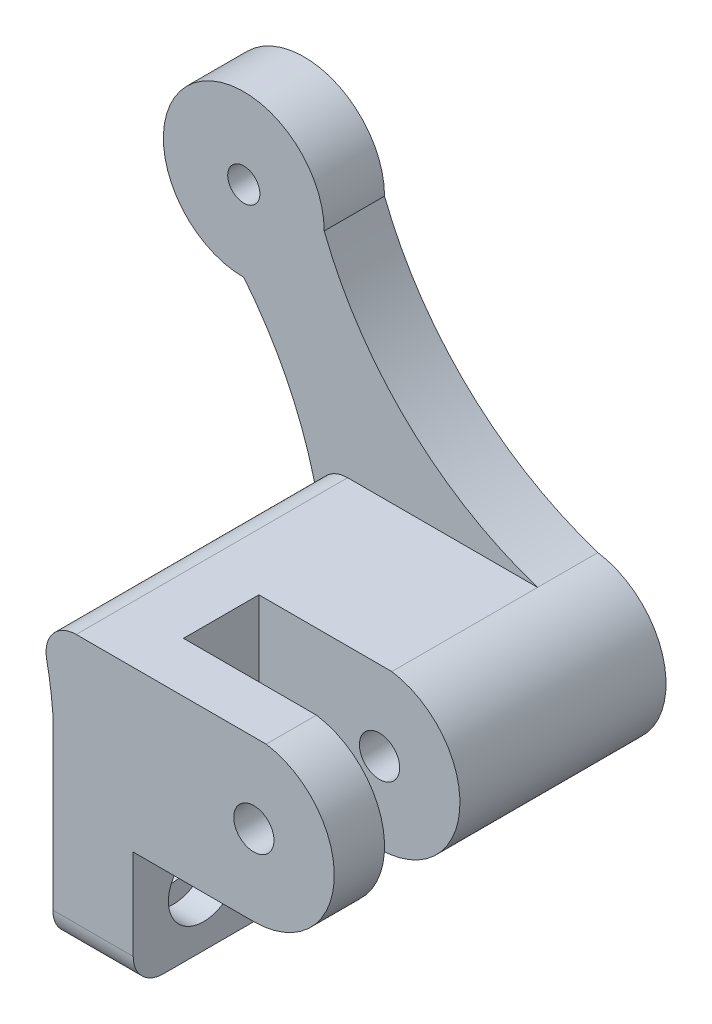
from build123d import *

# Parameters (mm, degrees)
SKETCH1_R           = 2
SKETCH1_R_2         = 1.6
BOSS_EXTRUDE6_DEPTH = 6
SKETCH1_6_R         = 2
BOSS_EXTRUDE7_DEPTH = 33
CUT_EXTRUDE1_START  = -12.5
CUT_EXTRUDE1_DEPTH  = 7.5
FILLET1_R           = 3
SKETCH3_R           = 1.6
CUT_EXTRUDE2_DEPTH  = 17.5
SKETCH4_R           = 3.5
SKETCH4_R_2         = 1.6
CUT_EXTRUDE3_DEPTH  = 3
FILLET2_R           = 3
SKETCH5_R           = 3.5
CUT_EXTRUDE6_DEPTH  = 4


with BuildPart() as part:
    # Sketch1 → Boss-Extrude6 (new body)
    with BuildSketch(Plane.XY):
        with BuildLine():
            Line((-12, -8), (0, -8))
            ThreePointArc((0, -8), (7.976389989, -0.614168335), (1.22471154, 7.905699314))
            ThreePointArc((1.22471154, 7.905699314), (-11.642163109, 15.571502149), (-20, 28))
            ThreePointArc((-20, 28), (-33.656854249, 33.656854249), (-28, 20))
            ThreePointArc((-28, 20), (-22.4925387, 10.60298452), (-20, 0))
            Line((-20, 0), (-20, -20))
            Line((-20, -20), (-12, -20))
            Line((-12, -20), (-12, -8))
        make_face()
        Circle(SKETCH1_R, mode=Mode.SUBTRACT)
        with Locations((-28, 28)):
            Circle(SKETCH1_R_2, mode=Mode.SUBTRACT)
    extrude(amount=BOSS_EXTRUDE6_DEPTH)

    # Sketch1<6> → Boss-Extrude7 (add)
    with BuildSketch(Plane.XY):
        with BuildLine():
            Line((-12, -8), (0, -8))
            ThreePointArc((0, -8), (7.976389989, -0.614168335), (1.22471154, 7.905699314))
            Line((1.22471154, 7.905699314), (-21.534392451, 7.905699314))
            ThreePointArc((-21.534392451, 7.905699314), (-20.548705212, 3.995255894), (-20, 0))
            Line((-20, 0), (-20, -20))
            Line((-20, -20), (-12, -20))
            Line((-12, -20), (-12, -8))
        make_face()
        Circle(SKETCH1_6_R, mode=Mode.SUBTRACT)
    extrude(amount=BOSS_EXTRUDE7_DEPTH)

    # Sketch2 → Cut-Extrude1 (cut)
    with BuildSketch(Plane.XY.offset(33).offset(CUT_EXTRUDE1_START)):
        with BuildLine():
            Line((-12, -8), (-12, 7.905699314))
            Line((-12, 7.905699314), (1.22471154, 7.905699314))
            ThreePointArc((1.22471154, 7.905699314), (7.976389989, -0.614168335), (0, -8))
            Line((0, -8), (-12, -8))
        make_face()
    extrude(amount=CUT_EXTRUDE1_DEPTH, mode=Mode.SUBTRACT)

    # Fillet1
    fillet1_edges = [part.edges().sort_by_distance(p)[0] for p in [
        (-16, -20, 33),
        (-16, -20, 0),
    ]]
    fillet(fillet1_edges, radius=FILLET1_R)

    # Sketch3 → Cut-Extrude2 (cut)
    with BuildSketch(Plane(origin=(-12, 0, 0), x_dir=(0, 0, -1), z_dir=(1, 0, 0))):
        with Locations((-26, -14)):
            Circle(SKETCH3_R)
        with Locations((-7, -14)):
            Circle(SKETCH3_R)
    extrude(amount=-CUT_EXTRUDE2_DEPTH, mode=Mode.SUBTRACT)

    # Sketch4 → Cut-Extrude3 (cut)
    # profile 1 of 2: a face of its own
    with BuildSketch(Plane(origin=(-12, 0, 0), x_dir=(0, 0, -1), z_dir=(1, 0, 0))):
        with Locations((-26, -14)):
            Circle(SKETCH4_R)
        with Locations((-26, -14)):
            Circle(SKETCH4_R_2, mode=Mode.SUBTRACT)
    # profile 2 of 2: a face of its own
    with BuildSketch(Plane(origin=(-12, 0, 0), x_dir=(0, 0, -1), z_dir=(1, 0, 0))):
        with Locations((-7, -14)):
            Circle(SKETCH4_R)
    extrude(amount=-CUT_EXTRUDE3_DEPTH, mode=Mode.SUBTRACT)

    # Fillet2
    fillet2_edges = [part.edges().sort_by_distance(p)[0] for p in [
        (-21.534392451, 7.905699314, 19.5),
    ]]
    fillet(fillet2_edges, radius=FILLET2_R)

    # Sketch5 → Cut-Extrude6 (cut)
    with BuildSketch(Plane(origin=(0, 0, 0), x_dir=(-1, 0, 0), z_dir=(0, 0, -1))):
        Circle(SKETCH5_R)
    extrude(amount=-CUT_EXTRUDE6_DEPTH, mode=Mode.SUBTRACT)


solid = part.part
